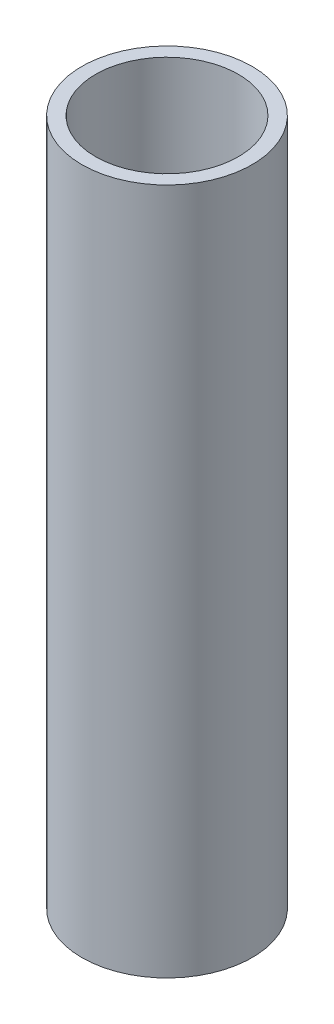
from build123d import *

# Parameters (mm, degrees)
SKETCH1_R           = 12.4
SKETCH1_R_2         = 10.4
BOSS_EXTRUDE1_DEPTH = 100


with BuildPart() as part:
    # Sketch1 → Boss-Extrude1 (new body)
    with BuildSketch(Plane(origin=(0, 0, 0), x_dir=(1, 0, 0), z_dir=(0, 1, 0))):
        with Locations(Location((0, 0, 0), (0, 0, 270))):
            Circle(SKETCH1_R)
        with Locations(Location((0, 0, 0), (0, 0, 270))):
            Circle(SKETCH1_R_2, mode=Mode.SUBTRACT)
    extrude(amount=BOSS_EXTRUDE1_DEPTH)


solid = part.part
